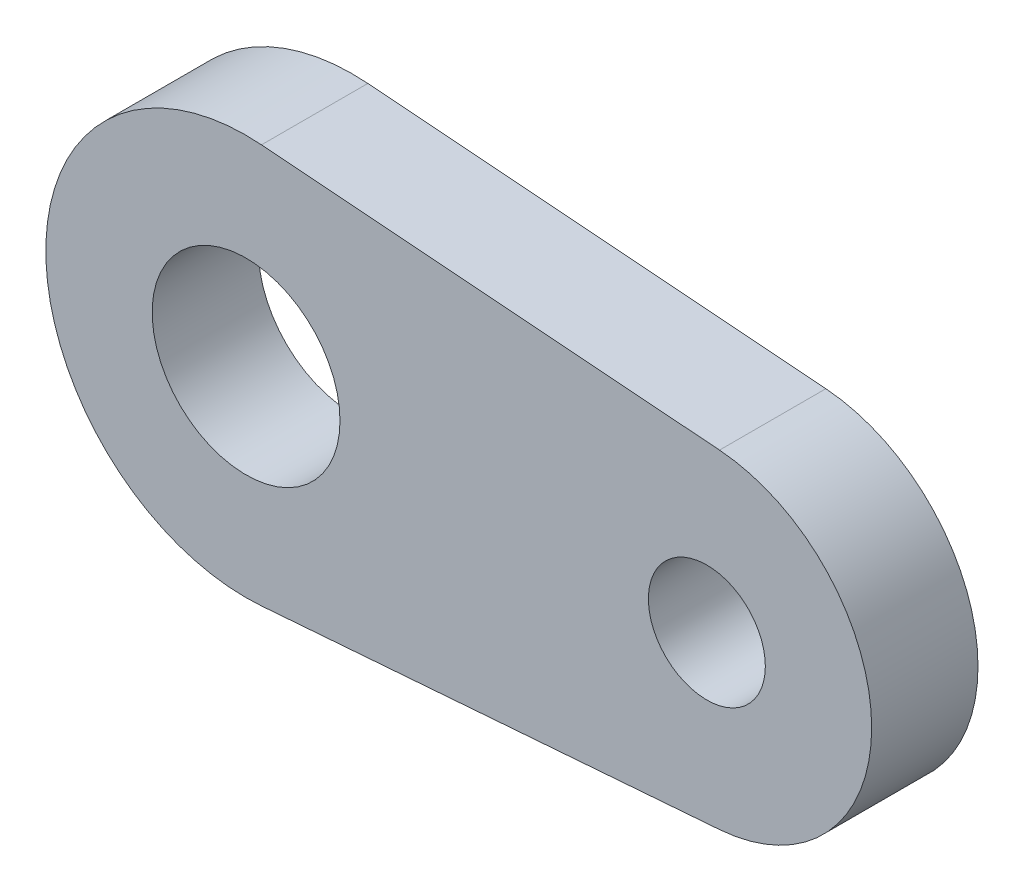
from build123d import *

# Parameters (mm, degrees)
SKETCH1_R           = 2.65
SKETCH1_R_2         = 1.65
BOSS_EXTRUDE1_DEPTH = 1.5


with BuildPart() as part:
    # Sketch1 → Boss-Extrude1 (new, symmetric)
    with BuildSketch(Plane.XY):
        with BuildLine():
            Line((0.434615385, 5.633259222), (13.357692308, 4.636222192))
            ThreePointArc((13.357692308, 4.636222192), (17.65, 0), (13.357692308, -4.636222192))
            Line((13.357692308, -4.636222192), (0.434615385, -5.633259222))
            ThreePointArc((0.434615385, -5.633259222), (-5.65, 0), (0.434615385, 5.633259222))
        make_face()
        Circle(SKETCH1_R, mode=Mode.SUBTRACT)
        with Locations((13, 0)):
            Circle(SKETCH1_R_2, mode=Mode.SUBTRACT)
    extrude(amount=BOSS_EXTRUDE1_DEPTH, both=True)


solid = part.part
